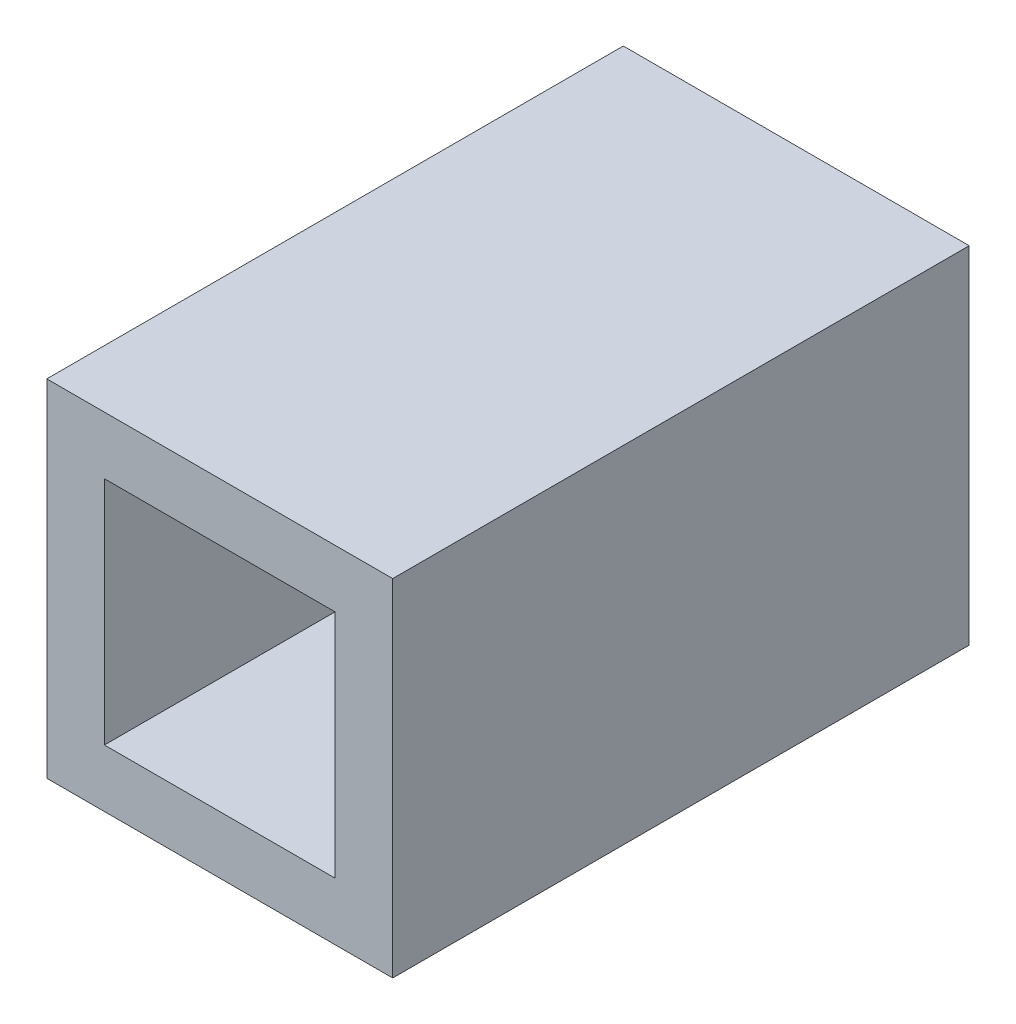
from build123d import *

# Parameters (mm, degrees)
SKETCH1_W           = 100
SKETCH1_H           = 60
BOSS_EXTRUDE1_DEPTH = 30
SKETCH2_W           = 100
SKETCH2_H           = 40
CUT_EXTRUDE1_DEPTH  = 20


with BuildPart() as part:
    # Sketch1 → Boss-Extrude1 (new, symmetric)
    with BuildSketch(Plane(origin=(0, 0, 0), x_dir=(0, 0, -1), z_dir=(1, 0, 0))):
        with Locations((-50, 0)):
            Rectangle(SKETCH1_W, SKETCH1_H)
    extrude(amount=BOSS_EXTRUDE1_DEPTH, both=True)

    # Sketch2 → Cut-Extrude1 (cut, symmetric)
    with BuildSketch(Plane(origin=(0, 0, 0), x_dir=(0, 0, -1), z_dir=(1, 0, 0))):
        with Locations((-50, 0)):
            Rectangle(SKETCH2_W, SKETCH2_H)
    extrude(amount=CUT_EXTRUDE1_DEPTH, both=True, mode=Mode.SUBTRACT)


solid = part.part
